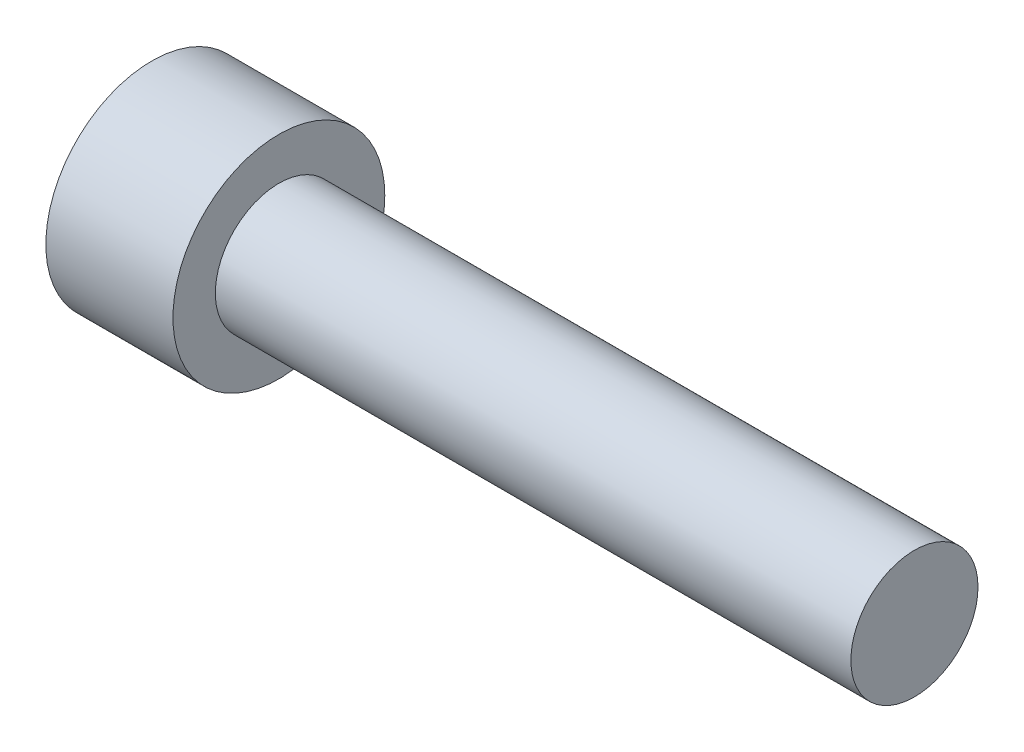
from build123d import *


with BuildPart() as part:
    # Sketch1 → Revolve1 (revolve)
    with BuildSketch(Plane(origin=(0, 0, 0), x_dir=(1, 0, 0), z_dir=(0, 1, 0))):
        Polygon((0, 0), (0, 2.5), (3, 2.5), (3, 1.5), (18, 1.5), (18, 0), align=None)
    revolve(axis=Axis((18, 0, 0), (-1, 0, 0)))


solid = part.part
